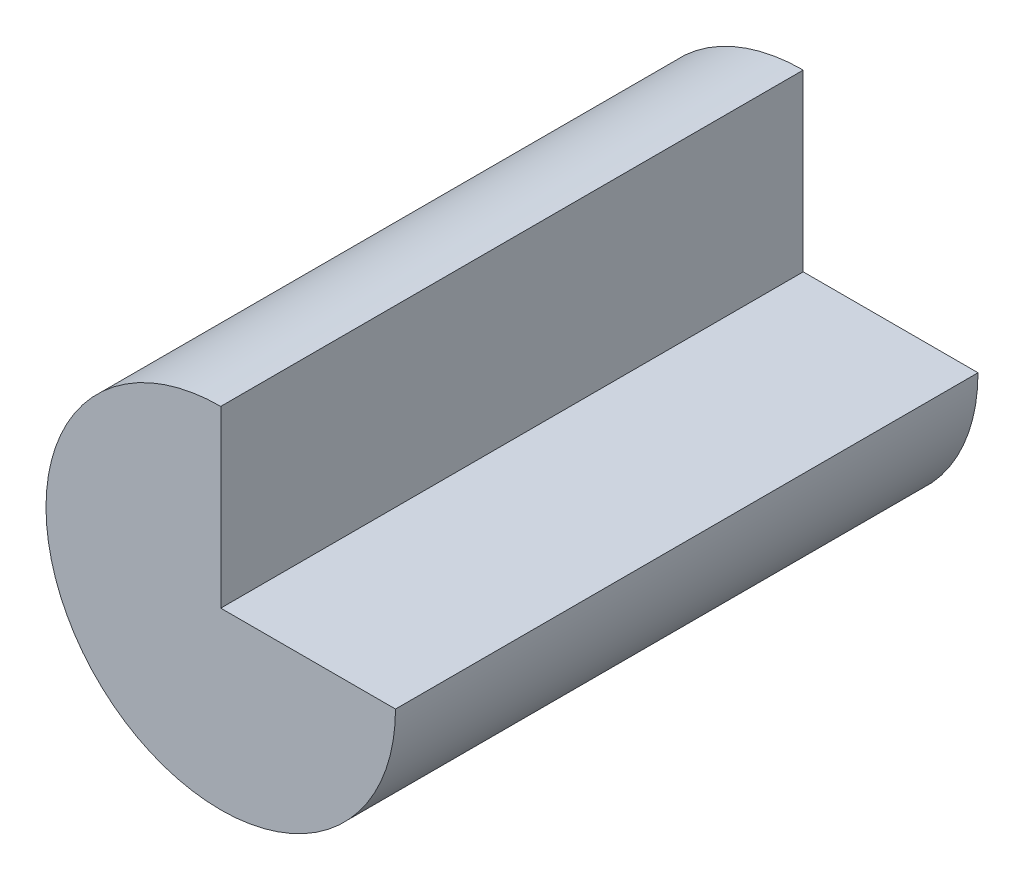
from build123d import *

# Parameters (mm, degrees)
SKETCH1_R           = 150
BOSS_EXTRUDE1_DEPTH = 500
SKETCH2_W           = 150
SKETCH2_H           = 150
CUT_EXTRUDE1_DEPTH  = 544.13902456


with BuildPart() as part:
    # Sketch1 → Boss-Extrude1 (new body)
    with BuildSketch(Plane.XY):
        Circle(SKETCH1_R)
    extrude(amount=-BOSS_EXTRUDE1_DEPTH)

    # Sketch2 → Cut-Extrude1 (cut, through all)
    with BuildSketch(Plane.XY):
        with Locations((75, 75)):
            Rectangle(SKETCH2_W, SKETCH2_H)
    extrude(amount=-CUT_EXTRUDE1_DEPTH, mode=Mode.SUBTRACT)


solid = part.part
